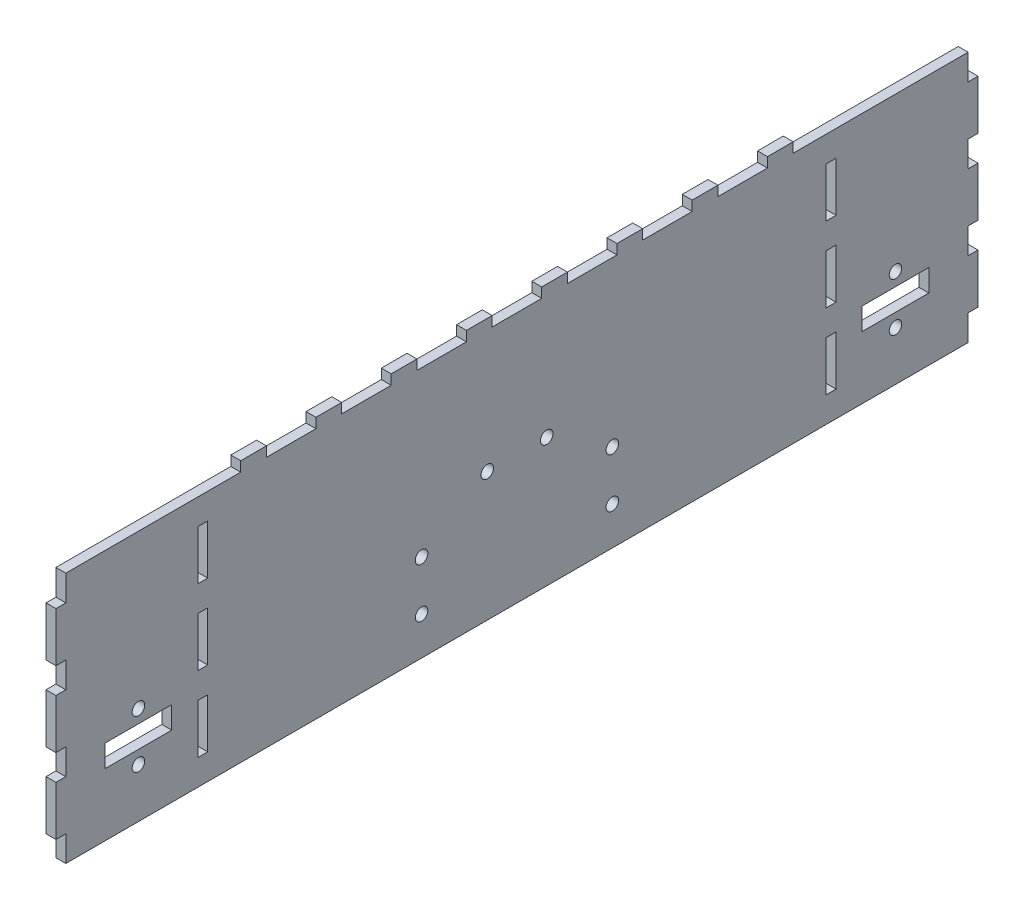
from build123d import *

# Parameters (mm, degrees)
SKETCH1_W               = 279.4
SKETCH1_H               = 76.2
BOSS_EXTRUDE1_DEPTH     = 3
SKETCH3_W               = 3
SKETCH3_H               = 7.8
CUT_EXTRUDE1_DEPTH      = 145.833352512
LPATTERN1_COUNT         = 4
LPATTERN1_PITCH         = 22.8
MIRROR1_COPY_1_SKETCH_W = 3
MIRROR1_COPY_1_SKETCH_H = 7.8
MIRROR1_COPY_1_DEPTH    = 145.833352512
MIRROR1_COPY_2_SKETCH_W = 3
MIRROR1_COPY_2_SKETCH_H = 7.8
MIRROR1_COPY_2_DEPTH    = 145.833352512
MIRROR1_COPY_3_SKETCH_W = 3
MIRROR1_COPY_3_SKETCH_H = 7.8
MIRROR1_COPY_3_DEPTH    = 145.833352512
SKETCH4_W               = 3
SKETCH4_H               = 15
CUT_EXTRUDE2_DEPTH      = 10
LPATTERN2_COUNT         = 3
LPATTERN2_PITCH         = 22.8
MIRROR2_COPY_1_SKETCH_W = 3
MIRROR2_COPY_1_SKETCH_H = 15
MIRROR2_COPY_1_DEPTH    = 10
MIRROR2_COPY_2_SKETCH_W = 3
MIRROR2_COPY_2_SKETCH_H = 15
MIRROR2_COPY_2_DEPTH    = 10
SKETCH5_W               = 3
SKETCH5_H               = 7.8
BOSS_EXTRUDE2_DEPTH     = 3
LPATTERN3_COUNT         = 8
LPATTERN3_PITCH         = 22.8
F_6_CLEARANCE_HOLE1_D   = 3.7973
F_6_CLEARANCE_HOLE2_D   = 3.7973
CUT_EXTRUDE3_REACH      = 147.651
SKETCH10_W              = 20.2
SKETCH10_H              = 6.7
F_6_CLEARANCE_HOLE3_D   = 3.7973


with BuildPart() as part:
    # Sketch1 → Boss-Extrude1 (new body)
    with BuildSketch(Plane(origin=(0, 0, 0), x_dir=(0, 0, -1), z_dir=(1, 0, 0))):
        Rectangle(SKETCH1_W, SKETCH1_H)
    extrude(amount=-BOSS_EXTRUDE1_DEPTH)

    # Sketch3 → Cut-Extrude1 (cut, through all)
    with BuildSketch(Plane.ZY.offset(3)):
        with Locations((-138.2, 34.2)):
            Rectangle(SKETCH3_W, SKETCH3_H)
    cut_extrude1 = extrude(amount=-CUT_EXTRUDE1_DEPTH, mode=Mode.SUBTRACT)

    # LPattern1: Cut-Extrude1 ×4
    with Locations(*[(0, -i * LPATTERN1_PITCH, 0) for i in range(1, LPATTERN1_COUNT)]):
        add(cut_extrude1, mode=Mode.SUBTRACT)

    # Mirror1: Cut-Extrude1 across plane
    add(cut_extrude1.mirror(Plane.XY), mode=Mode.SUBTRACT)

    # Mirror1 copy 1 sketch → Mirror1 copy 1 (cut, through all)
    with BuildSketch(Plane(origin=(-3, -22.8, 0), x_dir=(0, 0, -1), z_dir=(-1, 0, 0))):
        with Locations((-138.2, -34.2)):
            Rectangle(MIRROR1_COPY_1_SKETCH_W, MIRROR1_COPY_1_SKETCH_H)
    extrude(amount=-MIRROR1_COPY_1_DEPTH, mode=Mode.SUBTRACT)

    # Mirror1 copy 2 sketch → Mirror1 copy 2 (cut, through all)
    with BuildSketch(Plane(origin=(-3, -45.6, 0), x_dir=(0, 0, -1), z_dir=(-1, 0, 0))):
        with Locations((-138.2, -34.2)):
            Rectangle(MIRROR1_COPY_2_SKETCH_W, MIRROR1_COPY_2_SKETCH_H)
    extrude(amount=-MIRROR1_COPY_2_DEPTH, mode=Mode.SUBTRACT)

    # Mirror1 copy 3 sketch → Mirror1 copy 3 (cut, through all)
    with BuildSketch(Plane(origin=(-3, -68.4, 0), x_dir=(0, 0, -1), z_dir=(-1, 0, 0))):
        with Locations((-138.2, -34.2)):
            Rectangle(MIRROR1_COPY_3_SKETCH_W, MIRROR1_COPY_3_SKETCH_H)
    extrude(amount=-MIRROR1_COPY_3_DEPTH, mode=Mode.SUBTRACT)

    # Sketch4 → Cut-Extrude2 (cut)
    with BuildSketch(Plane(origin=(0, 0, 0), x_dir=(0, 0, -1), z_dir=(1, 0, 0))):
        with Locations((-95.2, 22.8)):
            Rectangle(SKETCH4_W, SKETCH4_H)
    cut_extrude2 = extrude(amount=-CUT_EXTRUDE2_DEPTH, mode=Mode.SUBTRACT)

    # LPattern2: Cut-Extrude2 ×3
    with Locations(*[(0, -i * LPATTERN2_PITCH, 0) for i in range(1, LPATTERN2_COUNT)]):
        add(cut_extrude2, mode=Mode.SUBTRACT)

    # Mirror2: Cut-Extrude2 across plane
    add(cut_extrude2.mirror(Plane.XY), mode=Mode.SUBTRACT)

    # Mirror2 copy 1 sketch → Mirror2 copy 1 (cut)
    with BuildSketch(Plane(origin=(0, -22.8, 0), x_dir=(0, 0, 1), z_dir=(1, 0, 0))):
        with Locations((-95.2, -22.8)):
            Rectangle(MIRROR2_COPY_1_SKETCH_W, MIRROR2_COPY_1_SKETCH_H)
    extrude(amount=-MIRROR2_COPY_1_DEPTH, mode=Mode.SUBTRACT)

    # Mirror2 copy 2 sketch → Mirror2 copy 2 (cut)
    with BuildSketch(Plane(origin=(0, -45.6, 0), x_dir=(0, 0, 1), z_dir=(1, 0, 0))):
        with Locations((-95.2, -22.8)):
            Rectangle(MIRROR2_COPY_2_SKETCH_W, MIRROR2_COPY_2_SKETCH_H)
    extrude(amount=-MIRROR2_COPY_2_DEPTH, mode=Mode.SUBTRACT)

    # Sketch5 → Boss-Extrude2 (add)
    with BuildSketch(Plane(origin=(0, 38.1, 0), x_dir=(1, 0, 0), z_dir=(0, 1, 0))):
        with Locations((-1.5, -79.8)):
            Rectangle(SKETCH5_W, SKETCH5_H)
    boss_extrude2 = extrude(amount=BOSS_EXTRUDE2_DEPTH)

    # LPattern3: Boss-Extrude2 ×8
    with Locations(*[(0, 0, -i * LPATTERN3_PITCH) for i in range(1, LPATTERN3_COUNT)]):
        add(boss_extrude2)

    # #6 Clearance Hole1 (through all)
    with Locations(Plane.ZY.offset(3)):
        with Locations((-28.9, -11.55), (-28.9, -26.55), (28.9, -26.55), (28.9, -11.55)):
            Hole(F_6_CLEARANCE_HOLE1_D / 2)

    # #6 Clearance Hole2 (through all)
    with Locations(Plane(origin=(0, 0, 0), x_dir=(0, 0, -1), z_dir=(1, 0, 0))):
        with Locations((-9, 0.9), (9, 0.9)):
            Hole(F_6_CLEARANCE_HOLE2_D / 2)

    # Sketch10 → Cut-Extrude3 (cut, up to next)
    with BuildSketch(Plane.ZY.offset(3), mode=Mode.PRIVATE) as cut_extrude3_sk1:
        with Locations((114.7, -15.8)):
            Rectangle(SKETCH10_W, SKETCH10_H)
    cut_extrude3_tool1 = extrude(cut_extrude3_sk1.sketch, amount=-CUT_EXTRUDE3_REACH, mode=Mode.PRIVATE) & part.part
    # Sketch10 → Cut-Extrude3 (cut, up to next)
    with BuildSketch(Plane.ZY.offset(3), mode=Mode.PRIVATE) as cut_extrude3_sk2:
        with Locations((-114.7, -15.8)):
            Rectangle(SKETCH10_W, SKETCH10_H)
    cut_extrude3_tool2 = extrude(cut_extrude3_sk2.sketch, amount=-CUT_EXTRUDE3_REACH, mode=Mode.PRIVATE) & part.part
    add(cut_extrude3_tool1.solids().sort_by_distance((-3, -15.8, 114.7))[0], mode=Mode.SUBTRACT)
    add(cut_extrude3_tool2.solids().sort_by_distance((-3, -15.8, -114.7))[0], mode=Mode.SUBTRACT)

    # #6 Clearance Hole3 (through all)
    with Locations(Plane.ZY.offset(3)):
        with Locations((-114.7, -8.45), (-114.7, -23.15), (114.7, -23.15), (114.7, -8.45)):
            Hole(F_6_CLEARANCE_HOLE3_D / 2)


solid = part.part
